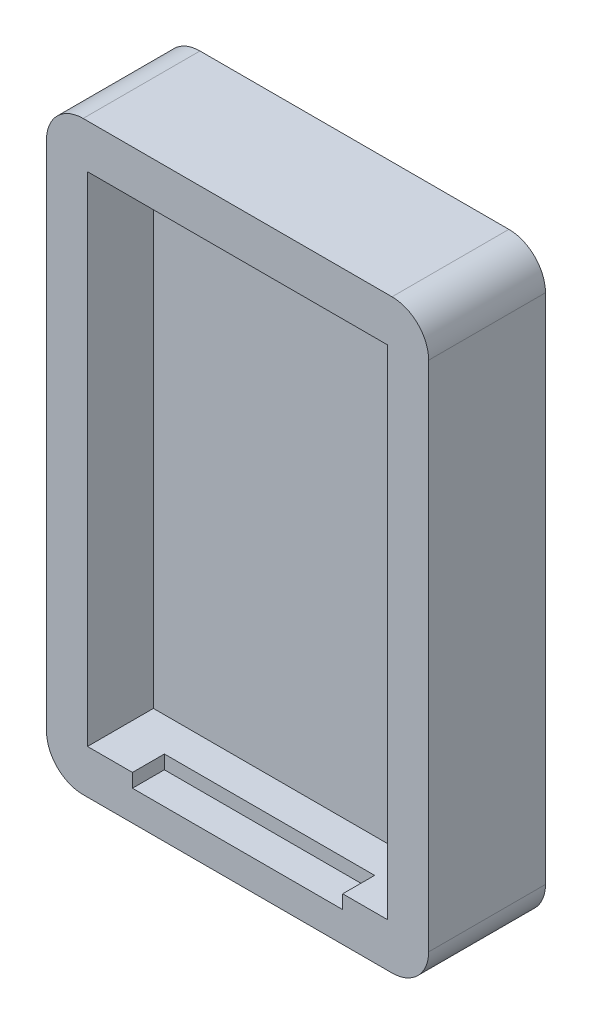
from build123d import *

# Parameters (mm, degrees)
ESQUISSE4_W              = 45
ESQUISSE4_H              = 68.965517242
BOSS_EXTRU_2_DEPTH       = 20
CONG_6_R                 = 4.310344828
ESQUISSE9_W              = 35.344827586
ESQUISSE9_H              = 58.620689655
ENL_V_MAT_EXTRU_7_DEPTH  = 14
ESQUISSE10_W             = 24.75862069
ESQUISSE10_H             = 1.613627587
ENL_V_MAT_EXTRU_8_DEPTH  = 10
ESQUISSE12_W             = 45
ESQUISSE12_H             = 68.965517242
ENL_V_MAT_EXTRU_11_DEPTH = 6.24
ESQUISSE14_W             = 6.210038645
ESQUISSE14_H             = 6.535729399
ENL_V_MAT_EXTRU_15_DEPTH = 3
ECHELLE2_SCALE           = 1.16


with BuildPart() as part:
    # Esquisse4 → Boss.-Extru.2 (new body)
    with BuildSketch(Plane.XY):
        with Locations((-111.0819834, 178.800149876)):
            Rectangle(ESQUISSE4_W, ESQUISSE4_H)
    extrude(amount=BOSS_EXTRU_2_DEPTH)

    # Congé6
    cong_6_edges = [part.edges().sort_by_distance(p)[0] for p in [
        (-133.5819834, 213.282908497, 10),
        (-88.5819834, 213.282908497, 10),
        (-88.5819834, 144.317391255, 10),
        (-133.5819834, 144.317391255, 10),
    ]]
    fillet(cong_6_edges, radius=CONG_6_R)

    # Esquisse9 → Enlèv. mat.-Extru.7 (cut)
    with BuildSketch(Plane.XY.offset(20)):
        with Locations((-111.081983607, 178.802563669)):
            Rectangle(ESQUISSE9_W, ESQUISSE9_H)
    extrude(amount=-ENL_V_MAT_EXTRU_7_DEPTH, mode=Mode.SUBTRACT)

    # Esquisse10 → Enlèv. mat.-Extru.8 (cut)
    with BuildSketch(Plane.XY.offset(20)):
        with Locations((-111.081983607, 148.685405049)):
            Rectangle(ESQUISSE10_W, ESQUISSE10_H)
    extrude(amount=-ENL_V_MAT_EXTRU_8_DEPTH, mode=Mode.SUBTRACT)

    # Esquisse12 → Enlèv. mat.-Extru.11 (cut)
    with BuildSketch(Plane.XY.offset(20)):
        with Locations((-111.0819834, 178.800149876)):
            Rectangle(ESQUISSE12_W, ESQUISSE12_H)
    extrude(amount=-ENL_V_MAT_EXTRU_11_DEPTH, mode=Mode.SUBTRACT)

    # Esquisse14 → Enlèv. mat.-Extru.15 (cut)
    with BuildSketch(Plane.XY):
        with Locations((-128.157742359, 165.722037811)):
            Rectangle(ESQUISSE14_W, ESQUISSE14_H)
        Polygon((-125.166077697, 194.70473497), (-131.262761681, 194.70473497), (-131.262761681, 175.305285642), (-124.939368374, 175.305285642), align=None)
        with BuildLine():
            add(Edge.make_bspline(
                [(-118.672815137, 173.299083951), (-119.122606069, 159.199358702), (-104.846253159, 158.743933226), (-90.56990025, 158.28850775), (-90.120109318, 172.388233)],
                knots=[0, 0, 0, 1.570796327, 1.570796327, 3.141592654, 3.141592654, 3.141592654], degree=2, weights=[1, 0.707106781, 1, 0.707106781, 1]))
            add(Edge.make_bspline(
                [(-104.31929668, 199.200388229), (-98.998777501, 190.741931467), (-90.339178369, 183.138148549), (-90.120109318, 172.388233)],
                knots=[0, 0, 0, 0, 1, 1, 1, 1], degree=3))
            add(Edge.make_bspline(
                [(-104.31929668, 199.200388229), (-109.644635947, 191.271995555), (-117.49611417, 183.324353593), (-118.672815137, 173.299083951)],
                knots=[0, 0, 0, 0, 1, 1, 1, 1], degree=3))
        make_face()
    extrude(amount=ENL_V_MAT_EXTRU_15_DEPTH, mode=Mode.SUBTRACT)


with BuildPart() as part_1:
    # Echelle2: scaled about (-111.392758629, 179.255556227, 5.432678967)
    add(part.part.scale(ECHELLE2_SCALE).moved(Location((17.822841381, -28.680888996, -0.869228635))))


solid = part_1.part
